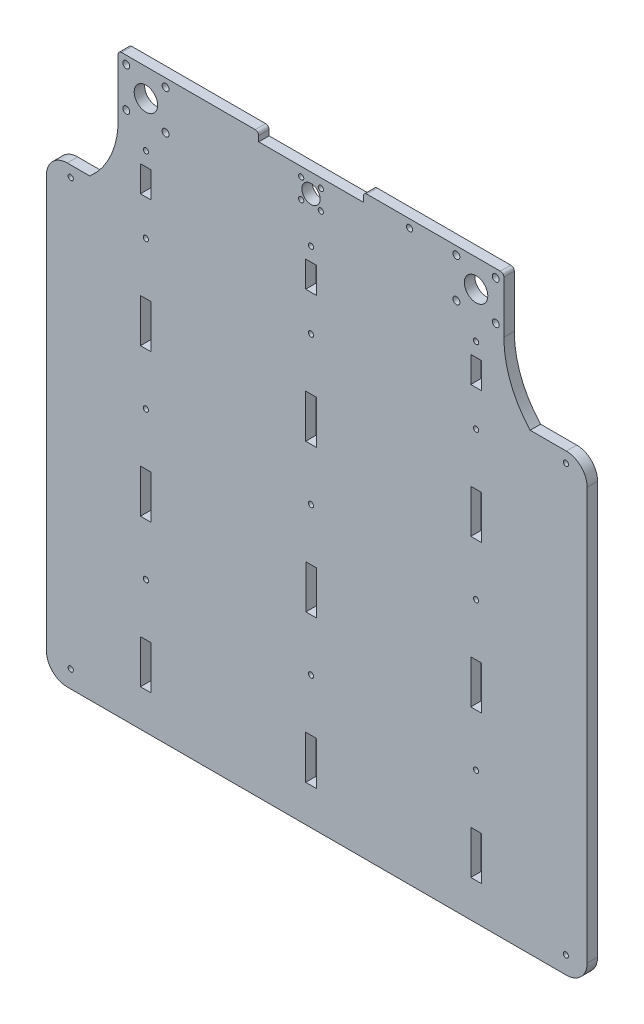
from build123d import *

# Parameters (mm, degrees)
CROQUIS1_R              = 1.5
CROQUIS1_W              = 6.2
CROQUIS1_H              = 25
CROQUIS1_H_2            = 15
CROQUIS1_R_2            = 2
CROQUIS1_R_3            = 6.75
CROQUIS1_R_4            = 5.25
CROQUIS1_R_5            = 1.75
SALIENTE_EXTRUIR1_DEPTH = 6


with BuildPart() as part:
    # Croquis1 → Saliente-Extruir1 (new body)
    with BuildSketch(Plane.XY):
        with BuildLine():
            Line((87.635637669, 16), (32.115377174, 16))
            ThreePointArc((32.115377174, 16), (30.701163612, 15.414213562), (30.115377174, 14))
            Line((30.115377174, 14), (30.115377174, 10.910010016))
            Line((30.115377174, 10.910010016), (-30.115377174, 10.910010016))
            Line((-30.115377174, 10.910010016), (-30.115377174, 14))
            ThreePointArc((-30.115377174, 14), (-30.701163612, 15.414213562), (-32.115377174, 16))
            Line((-32.115377174, 16), (-44.664398505, 16))
            Line((-44.664398505, 16), (-87.635637669, 16))
            Line((-87.635637669, 16), (-109, 16))
            ThreePointArc((-109, 16), (-110.414213562, 15.414213562), (-111, 14))
            Line((-111, 14), (-111, 0))
            Line((-111, 0), (-111, -15.999955929))
            ThreePointArc((-111, -15.999955929), (-114.684754838, -37.224148725), (-127.277573278, -54.701697231))
            Line((-127.277573278, -54.701697231), (-135.277573278, -54.701697231))
            Line((-135.277573278, -54.701697231), (-140.277573278, -54.701697231))
            ThreePointArc((-140.277573278, -54.701697231), (-148.762854653, -58.216415857), (-152.277573278, -66.701697231))
            Line((-152.277573278, -66.701697231), (-152.277573278, -303.912438798))
            ThreePointArc((-152.277573278, -303.912438798), (-148.762854653, -312.397720172), (-140.277573278, -315.912438798))
            Line((-140.277573278, -315.912438798), (-135.277573278, -315.912438798))
            Line((-135.277573278, -315.912438798), (-119.364295205, -315.912438798))
            Line((-119.364295205, -315.912438798), (119.364429455, -315.912438798))
            Line((119.364429455, -315.912438798), (130.295105026, -315.912438798))
            Line((130.295105026, -315.912438798), (146.942872896, -315.912438798))
            ThreePointArc((146.942872896, -315.912438798), (155.42815427, -312.397720172), (158.942872896, -303.912438798))
            Line((158.942872896, -303.912438798), (158.942872896, -70.770984471))
            Line((158.942872896, -70.770984471), (158.942872896, -66.701697231))
            ThreePointArc((158.942872896, -66.701697231), (155.42815427, -58.216415857), (146.942872896, -54.701697231))
            Line((146.942872896, -54.701697231), (126.134028278, -54.701697231))
            ThreePointArc((126.134028278, -54.701697231), (114.918041875, -36.777730062), (111, -15.999955929))
            Line((111, -15.999955929), (111, 14))
            ThreePointArc((111, 14), (110.414213562, 15.414213562), (109, 16))
            Line((109, 16), (87.635637669, 16))
        make_face()
        with Locations((-138.277573278, -305.912438798)):
            Circle(CROQUIS1_R, mode=Mode.SUBTRACT)
        with Locations((-95.05, -282.201697231)):
            Rectangle(CROQUIS1_W, CROQUIS1_H, mode=Mode.SUBTRACT)
        with Locations((-95, -239.701697231)):
            Circle(CROQUIS1_R, mode=Mode.SUBTRACT)
        Polygon((-3.049885808, -294.789219369), (-3.049896429, -269.789219369), (3.050103571, -269.789216778), (3.050114192, -294.789216778), align=None, mode=Mode.SUBTRACT)
        with Locations((9.0826e-05, -239.789218073)):
            Circle(CROQUIS1_R, mode=Mode.SUBTRACT)
        with Locations((-95.05, -197.201697231)):
            Rectangle(CROQUIS1_W, CROQUIS1_H, mode=Mode.SUBTRACT)
        with Locations((-95, -154.701697231)):
            Circle(CROQUIS1_R, mode=Mode.SUBTRACT)
        Polygon((-2.949921919, -209.789219327), (-2.94993254, -184.789219327), (3.15006746, -184.789216735), (3.150078081, -209.789216735), align=None, mode=Mode.SUBTRACT)
        with Locations((5.4715e-05, -154.789218073)):
            Circle(CROQUIS1_R, mode=Mode.SUBTRACT)
        Polygon((91.950125201, -294.701658167), (91.95011458, -269.701658167), (98.15011458, -269.701655533), (98.150125201, -294.701655533), align=None, mode=Mode.SUBTRACT)
        with Locations((146.722426722, -305.912438798)):
            Circle(CROQUIS1_R, mode=Mode.SUBTRACT)
        with Locations((95.000101835, -239.701656871)):
            Circle(CROQUIS1_R, mode=Mode.SUBTRACT)
        Polygon((91.95008909, -209.701658167), (91.950078469, -184.701658167), (98.150078469, -184.701655533), (98.15008909, -209.701655533), align=None, mode=Mode.SUBTRACT)
        with Locations((95.000065724, -154.701656871)):
            Circle(CROQUIS1_R, mode=Mode.SUBTRACT)
        with Locations((-95.05, -112.201697231)):
            Rectangle(CROQUIS1_W, CROQUIS1_H, mode=Mode.SUBTRACT)
        with Locations((-95, -69.701697231)):
            Circle(CROQUIS1_R, mode=Mode.SUBTRACT)
        Polygon((-3.04995803, -124.789219369), (-3.049968651, -99.789219369), (3.150031349, -99.789216735), (3.15004197, -124.789216735), align=None, mode=Mode.SUBTRACT)
        with Locations((1.8603e-05, -69.789218073)):
            Circle(CROQUIS1_R, mode=Mode.SUBTRACT)
        with Locations((-138.277573278, -60.912438798)):
            Circle(CROQUIS1_R, mode=Mode.SUBTRACT)
        with Locations((-95.05, -41.5)):
            Rectangle(CROQUIS1_W, CROQUIS1_H_2, mode=Mode.SUBTRACT)
        with Locations((-95, -26)):
            Circle(CROQUIS1_R, mode=Mode.SUBTRACT)
        with Locations((-106.313708499, -11.313708499)):
            Circle(CROQUIS1_R_2, mode=Mode.SUBTRACT)
        with Locations((-83.686291501, -11.313708499)):
            Circle(CROQUIS1_R_2, mode=Mode.SUBTRACT)
        with Locations((-95, 0)):
            Circle(CROQUIS1_R_3, mode=Mode.SUBTRACT)
        with Locations((-106.313708499, 11.313708499)):
            Circle(CROQUIS1_R_2, mode=Mode.SUBTRACT)
        with Locations((-83.686291501, 11.313708499)):
            Circle(CROQUIS1_R_2, mode=Mode.SUBTRACT)
        Polygon((-3.049990229, -48.999960936), (-3.049996601, -33.999960936), (3.150003399, -33.999958302), (3.150009771, -48.999958302), align=None, mode=Mode.SUBTRACT)
        with Locations((0.004600085, -25.999981675)):
            Circle(CROQUIS1_R, mode=Mode.SUBTRACT)
        with Locations((-5.656854249, -5.656854249)):
            Circle(CROQUIS1_R, mode=Mode.SUBTRACT)
        Circle(CROQUIS1_R_4, mode=Mode.SUBTRACT)
        with Locations((-5.656854249, 5.656854249)):
            Circle(CROQUIS1_R, mode=Mode.SUBTRACT)
        Polygon((91.950052978, -124.701658167), (91.950042357, -99.701658167), (98.150042357, -99.701655533), (98.150052978, -124.701655533), align=None, mode=Mode.SUBTRACT)
        with Locations((95.000029612, -69.701656871)):
            Circle(CROQUIS1_R, mode=Mode.SUBTRACT)
        with Locations((5.656854249, -5.656854249)):
            Circle(CROQUIS1_R, mode=Mode.SUBTRACT)
        with Locations((5.656854249, 5.656854249)):
            Circle(CROQUIS1_R, mode=Mode.SUBTRACT)
        with Locations((56.686291501, 11.313708499)):
            Circle(CROQUIS1_R_5, mode=Mode.SUBTRACT)
        Polygon((91.950020817, -48.999960936), (91.950014445, -33.999960936), (98.150014445, -33.999958302), (98.150020817, -48.999958302), align=None, mode=Mode.SUBTRACT)
        with Locations((95.000011046, -25.99995964)):
            Circle(CROQUIS1_R, mode=Mode.SUBTRACT)
        with Locations((146.722426722, -60.912438798)):
            Circle(CROQUIS1_R, mode=Mode.SUBTRACT)
        with Locations((83.686291501, -11.313708499)):
            Circle(CROQUIS1_R_2, mode=Mode.SUBTRACT)
        with Locations((106.313708499, -11.313708499)):
            Circle(CROQUIS1_R_2, mode=Mode.SUBTRACT)
        with Locations((95, 0)):
            Circle(CROQUIS1_R_3, mode=Mode.SUBTRACT)
        with Locations((83.686291501, 11.313708499)):
            Circle(CROQUIS1_R_2, mode=Mode.SUBTRACT)
        with Locations((106.313708499, 11.313708499)):
            Circle(CROQUIS1_R_2, mode=Mode.SUBTRACT)
    extrude(amount=SALIENTE_EXTRUIR1_DEPTH)


solid = part.part
